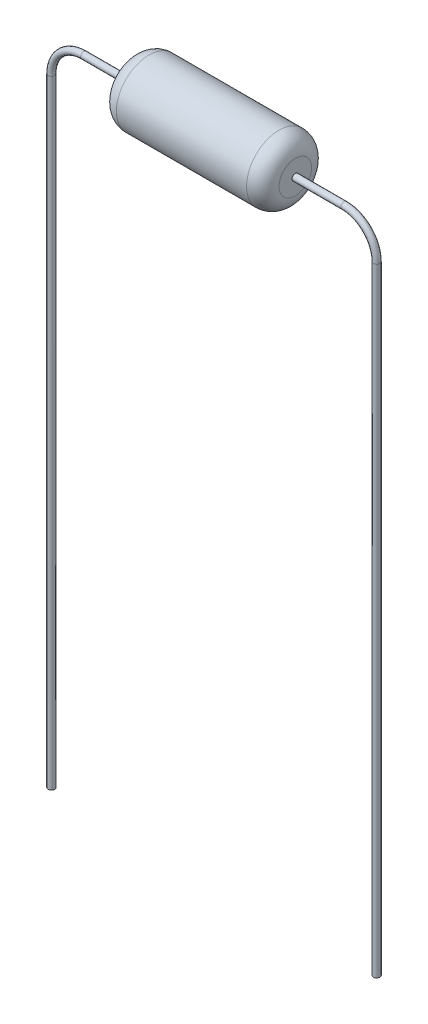
from build123d import *

# Parameters (mm, degrees)
SKETCH3_R = 0.1


with BuildPart() as part:
    # Sketch1 → Revolve1 (revolve)
    with BuildSketch(Plane.XY, mode=Mode.PRIVATE) as revolve1_sk:
        with BuildLine():
            Line((2.5, 0), (2.5, 0.5))
            ThreePointArc((2.5, 0.5), (2.353553391, 0.853553391), (2, 1))
            Line((2, 1), (-2, 1))
            ThreePointArc((-2, 1), (-2.353553391, 0.853553391), (-2.5, 0.5))
            Line((-2.5, 0.5), (-2.5, 0))
            Line((-2.5, 0), (2.5, 0))
        make_face()
    revolve(revolve1_sk.sketch.rotate(Axis((15.850565012, 0, 0), (-1, 0, 0)), 90), axis=Axis((15.850565012, 0, 0), (-1, 0, 0)))

    # Sweep1: sweep along a path in Sketch2
    with BuildLine(Plane.XY) as sweep1_path:
        Line((2.5, 0), (4, 0))
        ThreePointArc((4, 0), (4.707106781, -0.292893219), (5, -1))
        Line((5, -1), (5, -20))
    # Sketch3 → Sweep1 (sweep)
    with BuildSketch(Plane(origin=(2.5, 0, 0), x_dir=(0, 0, -1), z_dir=(1, 0, 0))):
        Circle(SKETCH3_R)
    sweep1 = sweep(path=sweep1_path.line)

    # Mirror1: Sweep1 across plane
    add(sweep1.mirror(Plane(origin=(0, 0, 0), x_dir=(0, 0, 1), z_dir=(1, 0, 0))))


solid = part.part
